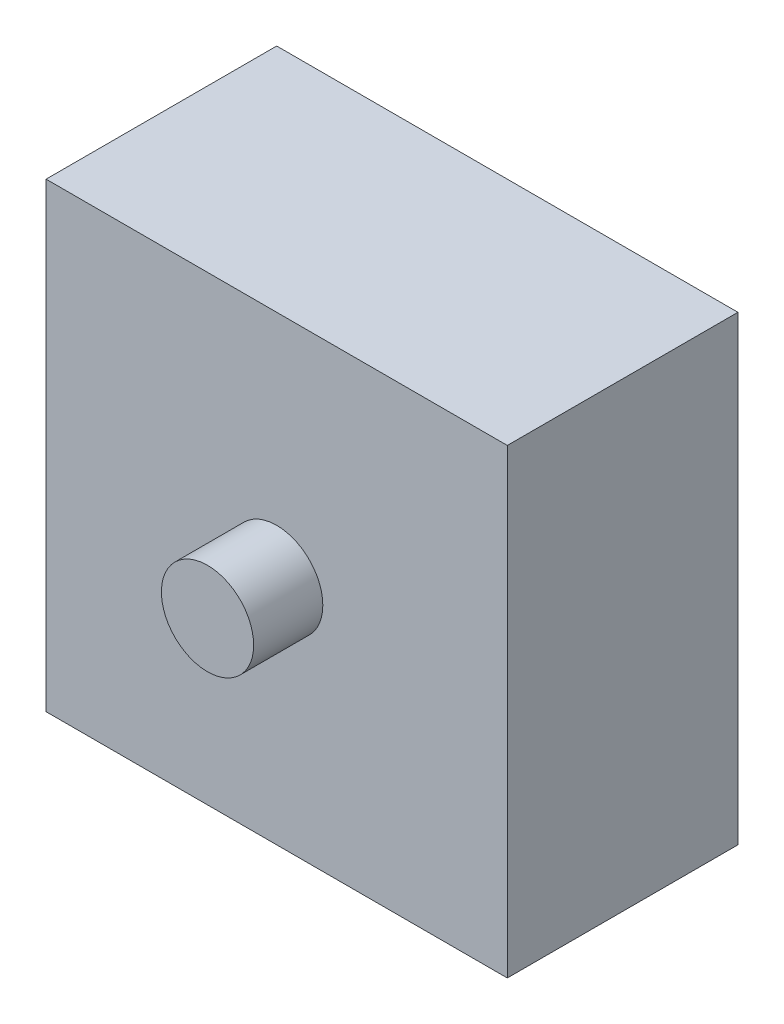
from build123d import *

# Parameters (mm, degrees)
SKETCH1_W           = 200
SKETCH1_H           = 200
BOSS_EXTRUDE1_DEPTH = 100
SKETCH2_R           = 20
BOSS_EXTRUDE2_DEPTH = 30


with BuildPart() as part:
    # Sketch1 → Boss-Extrude1 (new body)
    with BuildSketch(Plane.XY):
        Rectangle(SKETCH1_W, SKETCH1_H)
    extrude(amount=BOSS_EXTRUDE1_DEPTH)

    # Sketch2 → Boss-Extrude2 (add)
    with BuildSketch(Plane.XY.offset(100)):
        Circle(SKETCH2_R)
    extrude(amount=BOSS_EXTRUDE2_DEPTH)


solid = part.part
